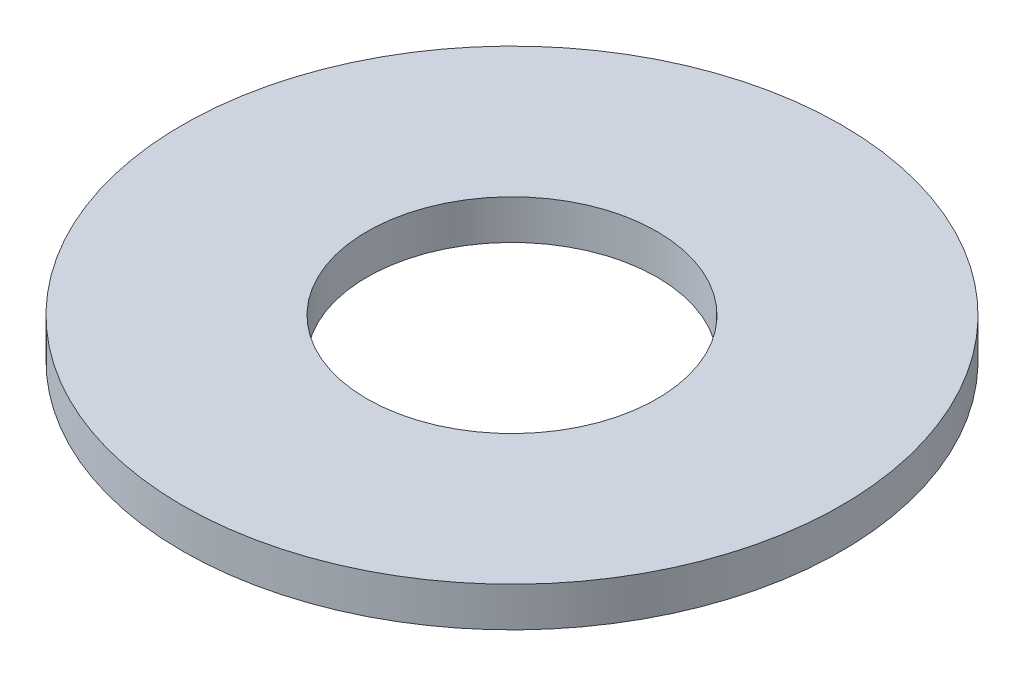
from build123d import *

# Parameters (mm, degrees)
SKETCH1_R           = 2.5
SKETCH1_R_2         = 1.1
BOSS_EXTRUDE1_DEPTH = 0.15


with BuildPart() as part:
    # Sketch1 → Boss-Extrude1 (new, symmetric)
    with BuildSketch(Plane(origin=(0, 0, 0), x_dir=(1, 0, 0), z_dir=(0, 1, 0))):
        Circle(SKETCH1_R)
        Circle(SKETCH1_R_2, mode=Mode.SUBTRACT)
    extrude(amount=BOSS_EXTRUDE1_DEPTH, both=True)


solid = part.part
